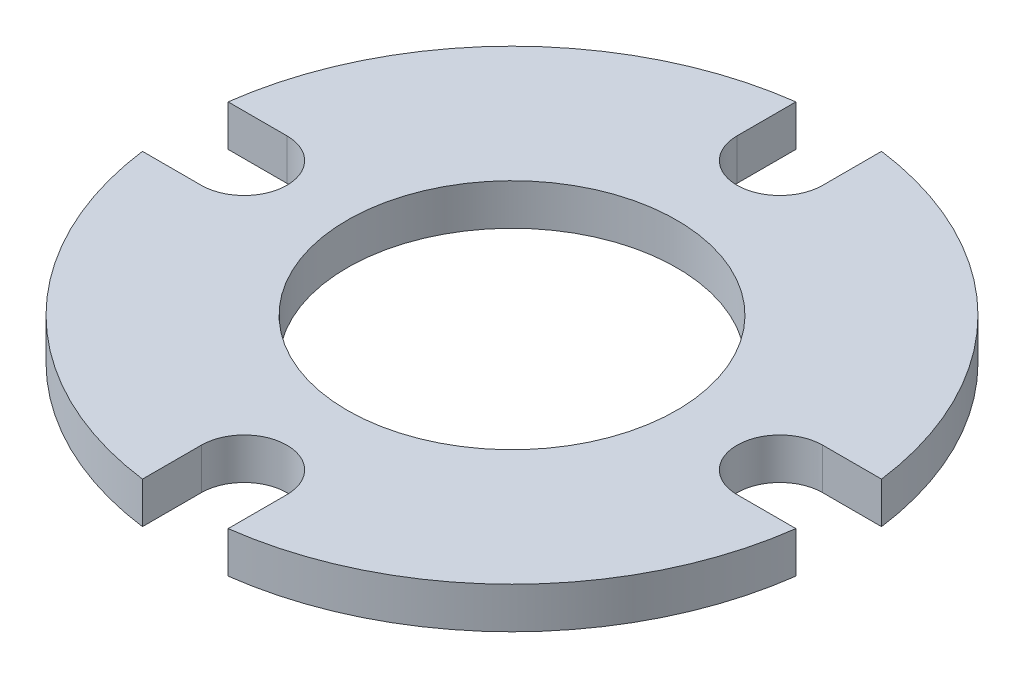
from build123d import *

# Parameters (mm, degrees)
SKETCH1_R           = 0.5
BOSS_EXTRUDE1_DEPTH = 0.125


with BuildPart() as part:
    # Sketch1 → Boss-Extrude1 (new body)
    with BuildSketch(Plane(origin=(0, 0, 0), x_dir=(1, 0, 0), z_dir=(0, 1, 0))):
        with BuildLine():
            Line((-0.991513994, 0.13), (-0.813, 0.13))
            ThreePointArc((-0.813, 0.13), (-0.683, 0), (-0.813, -0.13))
            Line((-0.813, -0.13), (-0.991513994, -0.13))
            ThreePointArc((-0.991513994, -0.13), (-0.707106781, -0.707106781), (-0.13, -0.991513994))
            Line((-0.13, -0.991513994), (-0.13, -0.813))
            ThreePointArc((-0.13, -0.813), (0, -0.683), (0.13, -0.813))
            Line((0.13, -0.813), (0.13, -0.991513994))
            ThreePointArc((0.13, -0.991513994), (0.707106781, -0.707106781), (0.991513994, -0.13))
            Line((0.991513994, -0.13), (0.813, -0.13))
            ThreePointArc((0.813, -0.13), (0.683, 0), (0.813, 0.13))
            Line((0.813, 0.13), (0.991513994, 0.13))
            ThreePointArc((0.991513994, 0.13), (0.707106781, 0.707106781), (0.13, 0.991513994))
            Line((0.13, 0.991513994), (0.13, 0.813))
            ThreePointArc((0.13, 0.813), (0, 0.683), (-0.13, 0.813))
            Line((-0.13, 0.813), (-0.13, 0.991513994))
            ThreePointArc((-0.13, 0.991513994), (-0.707106781, 0.707106781), (-0.991513994, 0.13))
        make_face()
        with Locations(Location((0, 0, 0), (0, 0, 270))):
            Circle(SKETCH1_R, mode=Mode.SUBTRACT)
    extrude(amount=BOSS_EXTRUDE1_DEPTH)


solid = part.part
